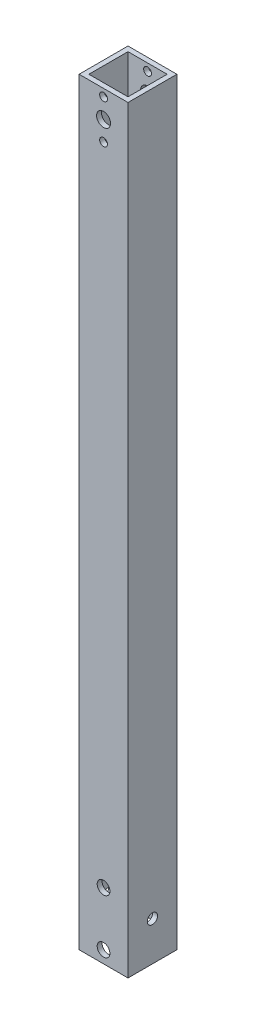
from build123d import *

# Parameters (mm, degrees)
ESBO_O1_W             = 20
ESBO_O1_H             = 20
ESBO_O1_W_2           = 16
ESBO_O1_H_2           = 16
EXTRUS_O_FINA1_DEPTH  = 310
ESBO_O4_R             = 2.85
ESBO_O4_R_2           = 1.6
CORTE_EXTRUS_O2_DEPTH = 312.287648325
ESBO_O5_R             = 2.6
CORTE_EXTRUS_O5_DEPTH = 312.287648325
ESBO_O6_R             = 2.1
CORTE_EXTRUS_O6_DEPTH = 312.287648325


with BuildPart() as part:
    # Esboço1 → Extrusão-Fina1 (new body)
    with BuildSketch(Plane(origin=(0, 0, 0), x_dir=(1, 0, 0), z_dir=(0, 1, 0))):
        with Locations((10, 10)):
            Rectangle(ESBO_O1_W, ESBO_O1_H)
        with Locations((10, 10)):
            Rectangle(ESBO_O1_W_2, ESBO_O1_H_2, mode=Mode.SUBTRACT)
    extrude(amount=EXTRUS_O_FINA1_DEPTH)

    # Esboço4 → Corte-extrusão2 (cut, through all)
    with BuildSketch(Plane.XY):
        with Locations((10, 299)):
            Circle(ESBO_O4_R)
        with Locations((10, 291)):
            Circle(ESBO_O4_R_2)
        with Locations((10, 307)):
            Circle(ESBO_O4_R_2)
    extrude(amount=-CORTE_EXTRUS_O2_DEPTH, mode=Mode.SUBTRACT)

    # Esboço5 → Corte-extrusão5 (cut, through all)
    with BuildSketch(Plane(origin=(0, 0, -20), x_dir=(-1, 0, 0), z_dir=(0, 0, -1))):
        with Locations((-10, 5)):
            Circle(ESBO_O5_R)
        with Locations((-10, 27)):
            Circle(ESBO_O5_R)
    extrude(amount=-CORTE_EXTRUS_O5_DEPTH, mode=Mode.SUBTRACT)

    # Esboço6 → Corte-extrusão6 (cut, through all)
    with BuildSketch(Plane.ZY):
        with Locations((-10, 16)):
            Circle(ESBO_O6_R)
    extrude(amount=-CORTE_EXTRUS_O6_DEPTH, mode=Mode.SUBTRACT)


solid = part.part
